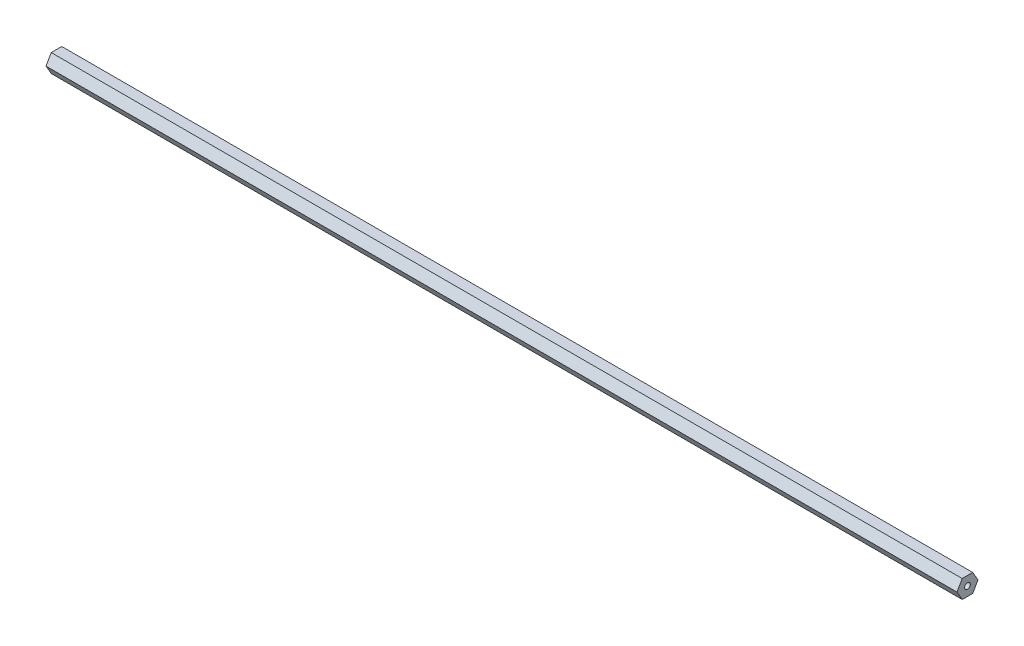
from build123d import *

# Parameters (mm, degrees)
SKETCH1_R           = 2.001318437
BOSS_EXTRUDE1_DEPTH = 635


with BuildPart() as part:
    # Sketch1 → Boss-Extrude1 (new body)
    with BuildSketch(Plane(origin=(0, 0, 0), x_dir=(0, 0, -1), z_dir=(1, 0, 0))):
        Polygon((3.650024925, 6.359296453), (-3.682299817, 6.340662536), (-7.332324741, -0.018633918), (-3.650024925, -6.359296453), (3.682299817, -6.340662536), (7.332324741, 0.018633918), align=None)
        with Locations(Location((0, 0, 0), (0, 0, 180))):
            Circle(SKETCH1_R, mode=Mode.SUBTRACT)
    extrude(amount=BOSS_EXTRUDE1_DEPTH)


solid = part.part
